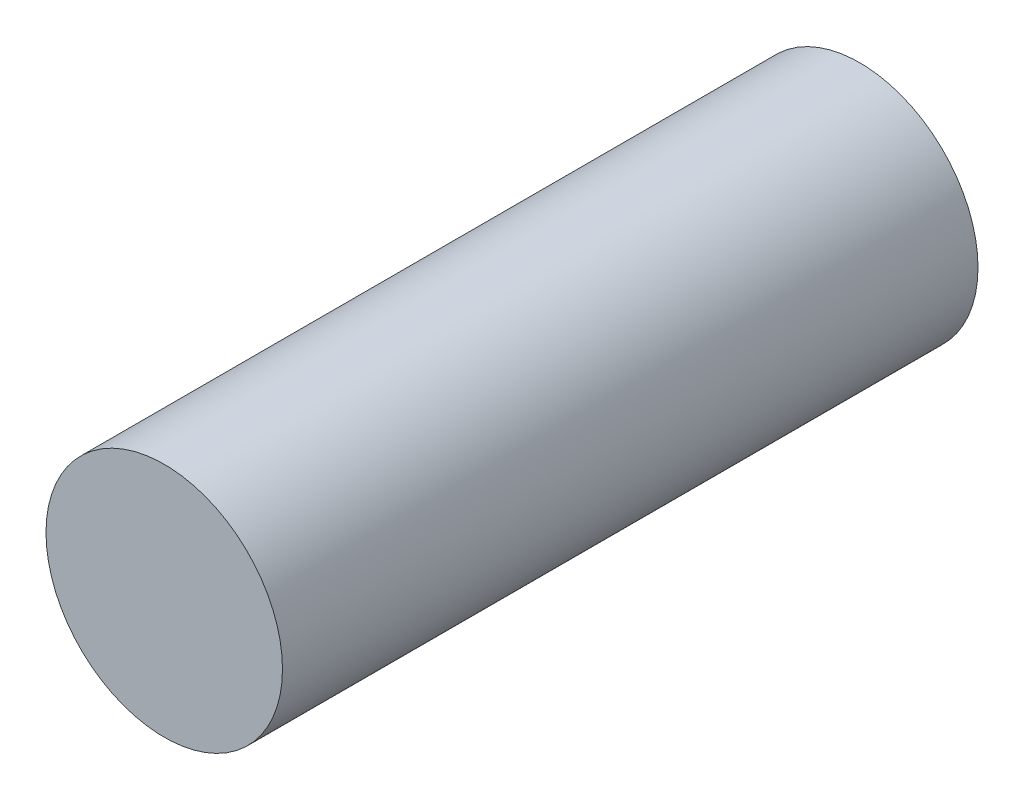
from build123d import *

# Parameters (mm, degrees)
SKETCH_1_R      = 17
EXTRUDE_1_DEPTH = 100


with BuildPart() as part:
    # 草图1 → 凸台-拉伸1 (new body)
    with BuildSketch(Plane.XY):
        Circle(SKETCH_1_R)
    extrude(amount=EXTRUDE_1_DEPTH)


solid = part.part
